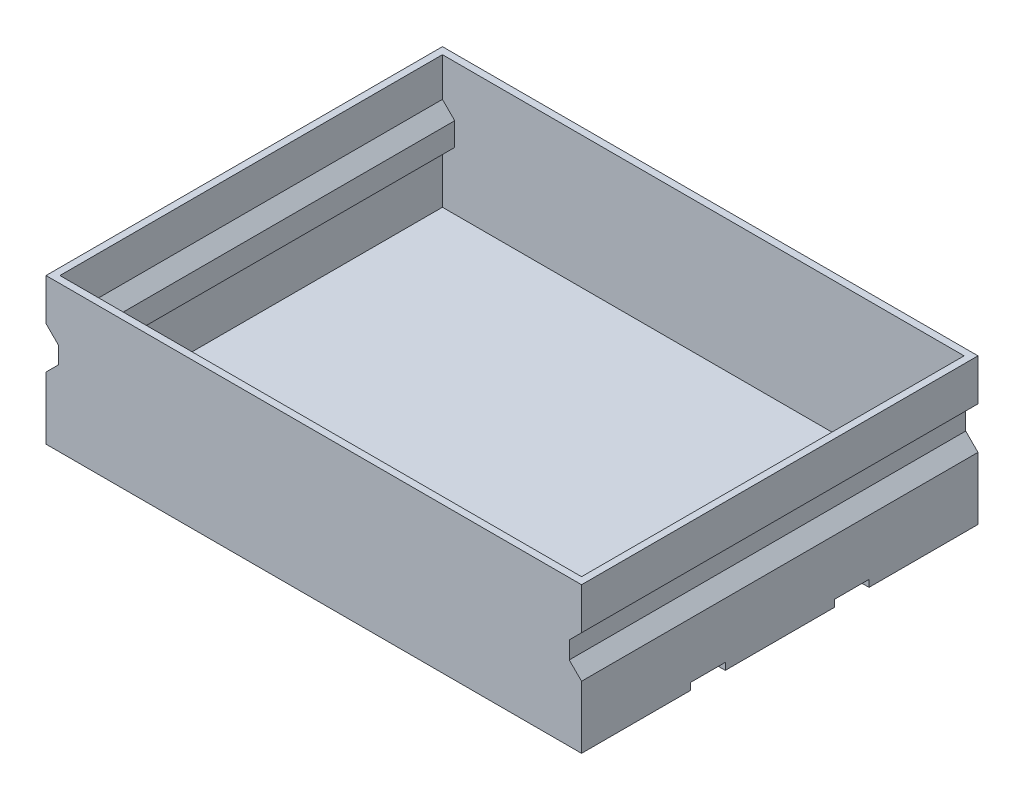
from build123d import *

# Parameters (mm, degrees)
SKETCH1_W                       = 154
SKETCH1_H                       = 114
SKETCH1_W_2                     = 150
SKETCH1_H_2                     = 110
BOSS_EXTRUDE1_DEPTH             = 2
BOSS_EXTRUDE2_REACH             = 97.823
BOSS_EXTRUDE2_DIRECTION_2_REACH = 97.823
BOSS_EXTRUDE3_DEPTH             = 2
SKETCH4_W                       = 154
SKETCH4_H                       = 31.333333333
SKETCH4_H_2                     = 31.333333334
BOSS_EXTRUDE4_DEPTH             = 2


with BuildPart() as part:
    # Sketch1 → Boss-Extrude1 (new body)
    # profile 1 of 3: a face of its own
    with BuildSketch(Plane(origin=(0, 0, 0), x_dir=(1, 0, 0), z_dir=(0, 1, 0))):
        Rectangle(SKETCH1_W, SKETCH1_H)
        Rectangle(SKETCH1_W_2, SKETCH1_H_2, mode=Mode.SUBTRACT)
    # profile 2 of 3: a face of its own
    with BuildSketch(Plane(origin=(0, 0, 0), x_dir=(1, 0, 0), z_dir=(0, 1, 0))):
        Polygon((-75, 55), (-75, -55), (75, -55), align=None)
    # profile 3 of 3: a face of its own
    with BuildSketch(Plane(origin=(0, 0, 0), x_dir=(1, 0, 0), z_dir=(0, 1, 0))):
        Polygon((75, 55), (75, -55), (-75, 55), align=None)
    extrude(amount=-BOSS_EXTRUDE1_DEPTH)

    # Boss-Extrude2: up to this face of the body (flat: up to its plane)
    boss_extrude2_end = Plane(part.part.faces().sort_by_distance((0, -1, 57))[0])
    # Sketch2 → Boss-Extrude2 (add, up to the picked face)
    with BuildSketch(Plane.XY, mode=Mode.PRIVATE) as boss_extrude2_sk1:
        Polygon((-77, 0), (-77, 13.964466094), (-73.464466094, 17.5), (-73.464466094, 22.5), (-77, 26.035533906), (-77, 38), (-75, 38), (-75, 26.863961031), (-71.464466094, 23.328427125), (-71.464466094, 22.5), (-71.464466094, 17.5), (-71.464466094, 16.671572875), (-75, 13.136038969), (-75, 0), align=None)
    boss_extrude2_tool1 = split(extrude(boss_extrude2_sk1.sketch, amount=BOSS_EXTRUDE2_REACH, mode=Mode.PRIVATE), bisect_by=boss_extrude2_end, keep=Keep.BOTH, mode=Mode.PRIVATE)
    # Sketch2 → Boss-Extrude2 (add, up to the picked face)
    with BuildSketch(Plane.XY, mode=Mode.PRIVATE) as boss_extrude2_sk2:
        Polygon((75, 38), (75, 26.863961031), (71.464466094, 23.328427125), (71.464466094, 22.5), (71.464466094, 17.5), (71.464466094, 16.671572875), (75, 13.136038969), (75, 0), (77, 0), (77, 13.964466094), (73.464466094, 17.5), (73.464466094, 22.5), (77, 26.035533906), (77, 38), align=None)
    boss_extrude2_tool2 = split(extrude(boss_extrude2_sk2.sketch, amount=BOSS_EXTRUDE2_REACH, mode=Mode.PRIVATE), bisect_by=boss_extrude2_end, keep=Keep.BOTH, mode=Mode.PRIVATE)
    add(boss_extrude2_tool1.solids().sort_by(Axis((-76.615989, 6.982233, 0), (0, 0, 1)))[0])
    add(boss_extrude2_tool2.solids().sort_by(Axis((75.384011, 32.431981, 0), (0, 0, 1)))[0])

    # Boss-Extrude2 direction 2: up to this face of the body (flat: up to its plane)
    boss_extrude2_direction_2_end = Plane(part.part.faces().sort_by_distance((0, -1, -57))[0])
    # Sketch2 → Boss-Extrude2 direction 2 (add, up to the picked face)
    with BuildSketch(Plane.XY, mode=Mode.PRIVATE) as boss_extrude2_direction_2_sk1:
        Polygon((-77, 0), (-77, 13.964466094), (-73.464466094, 17.5), (-73.464466094, 22.5), (-77, 26.035533906), (-77, 38), (-75, 38), (-75, 26.863961031), (-71.464466094, 23.328427125), (-71.464466094, 22.5), (-71.464466094, 17.5), (-71.464466094, 16.671572875), (-75, 13.136038969), (-75, 0), align=None)
    boss_extrude2_direction_2_tool1 = split(extrude(boss_extrude2_direction_2_sk1.sketch, amount=-BOSS_EXTRUDE2_DIRECTION_2_REACH, mode=Mode.PRIVATE), bisect_by=boss_extrude2_direction_2_end, keep=Keep.BOTH, mode=Mode.PRIVATE)
    # Sketch2 → Boss-Extrude2 direction 2 (add, up to the picked face)
    with BuildSketch(Plane.XY, mode=Mode.PRIVATE) as boss_extrude2_direction_2_sk2:
        Polygon((75, 38), (75, 26.863961031), (71.464466094, 23.328427125), (71.464466094, 22.5), (71.464466094, 17.5), (71.464466094, 16.671572875), (75, 13.136038969), (75, 0), (77, 0), (77, 13.964466094), (73.464466094, 17.5), (73.464466094, 22.5), (77, 26.035533906), (77, 38), align=None)
    boss_extrude2_direction_2_tool2 = split(extrude(boss_extrude2_direction_2_sk2.sketch, amount=-BOSS_EXTRUDE2_DIRECTION_2_REACH, mode=Mode.PRIVATE), bisect_by=boss_extrude2_direction_2_end, keep=Keep.BOTH, mode=Mode.PRIVATE)
    add(boss_extrude2_direction_2_tool1.solids().sort_by(Axis((-76.615989, 6.982233, 0), (0, 0, -1)))[0])
    add(boss_extrude2_direction_2_tool2.solids().sort_by(Axis((75.384011, 32.431981, 0), (0, 0, -1)))[0])

    # Sketch3 → Boss-Extrude3 (add)
    with BuildSketch(Plane(origin=(0, 0, -57), x_dir=(-1, 0, 0), z_dir=(0, 0, -1))):
        Polygon((-75, 38), (75, 38), (75, 26.863961031), (71.464466094, 23.328427125), (71.464466094, 16.671572875), (75, 13.136038969), (75, 0), (-75, 0), (-75, 13.136038969), (-71.464466094, 16.671572875), (-71.464466094, 23.328427125), (-75, 26.863961031), align=None)
    boss_extrude3 = extrude(amount=-BOSS_EXTRUDE3_DEPTH)

    # Mirror1: Boss-Extrude3 across plane
    add(boss_extrude3.mirror(Plane.XY))

    # Sketch4 → Boss-Extrude4 (add)
    with BuildSketch(Plane.XZ.offset(2)):
        with Locations((0, -41.333333334)):
            Rectangle(SKETCH4_W, SKETCH4_H)
        Rectangle(SKETCH4_W, SKETCH4_H_2)
        with Locations((0, 41.333333334)):
            Rectangle(SKETCH4_W, SKETCH4_H)
    extrude(amount=BOSS_EXTRUDE4_DEPTH)


solid = part.part
